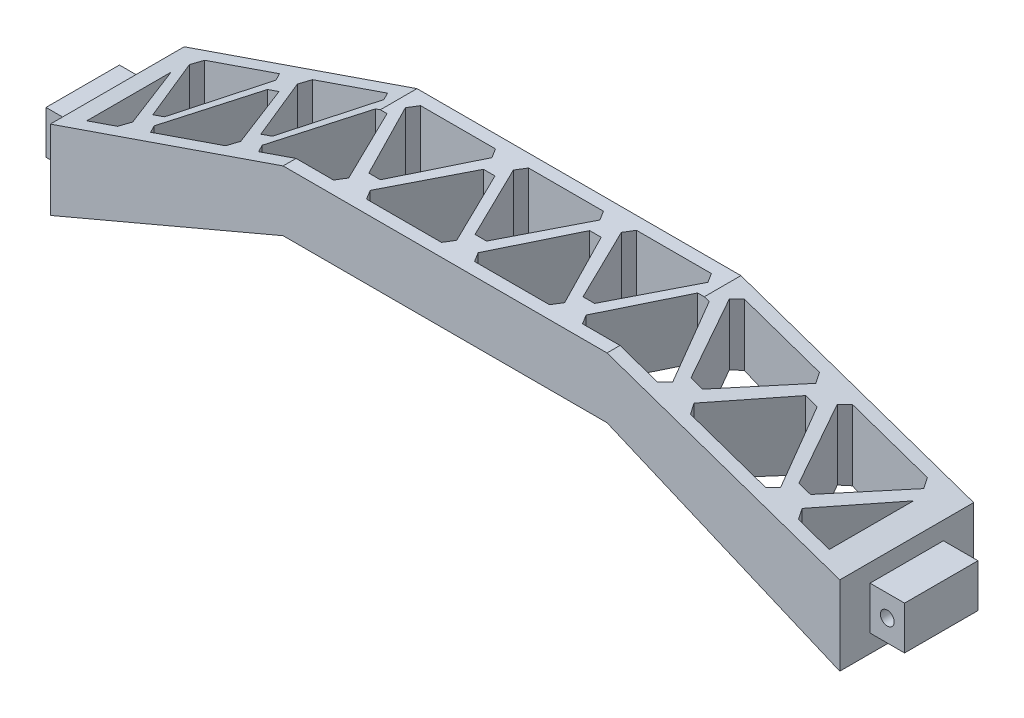
from build123d import *

# Parameters (mm, degrees)
CROQUIS1_W              = 37.5
CROQUIS1_H              = 14
SALIENTE_EXTRUIR1_DEPTH = 15.5
CROQUIS2_W              = 17
CROQUIS2_H              = 10
SALIENTE_EXTRUIR2_DEPTH = 8
CROQUIS3_R              = 1.6
CORTAR_EXTRUIR1_DEPTH   = 107.526693573
CORTAR_EXTRUIR2_DEPTH   = 108.142287781


with BuildPart() as part:
    # Croquis1 → Saliente-Extruir1 (new, symmetric)
    with BuildSketch(Plane.XY):
        Polygon((-91.394558809, -11.557384804), (-91.394558809, -29.877384804), (-37.5, -7), (-37.5, 7), align=None)
        Polygon((37.5, 7), (91.394558809, -11.557384804), (91.394558809, -29.877384804), (37.5, -7), align=None)
        with Locations((18.75, 0)):
            Rectangle(CROQUIS1_W, CROQUIS1_H)
        with Locations((-18.75, 0)):
            Rectangle(CROQUIS1_W, CROQUIS1_H)
    extrude(amount=SALIENTE_EXTRUIR1_DEPTH, both=True)

    # Croquis2 → Saliente-Extruir2 (add)
    with BuildSketch(Plane.ZY.offset(91.394558809)):
        with Locations((0, -20.717384804)):
            Rectangle(CROQUIS2_W, CROQUIS2_H)
    saliente_extruir2 = extrude(amount=SALIENTE_EXTRUIR2_DEPTH)

    # Croquis3 → Cortar-Extruir1 (cut, through all)
    with BuildSketch(Plane.XY.offset(8.5)):
        with Locations((-95.394558809, -20.717384804)):
            Circle(CROQUIS3_R)
    cortar_extruir1 = extrude(amount=-CORTAR_EXTRUIR1_DEPTH, mode=Mode.SUBTRACT)

    # Simetría1: Saliente-Extruir2, Cortar-Extruir1 across plane
    add(saliente_extruir2.mirror(Plane(origin=(0, 0, 0), x_dir=(0, 0, 1), z_dir=(1, 0, 0))))
    add(cortar_extruir1.mirror(Plane(origin=(0, 0, 0), x_dir=(0, 0, 1), z_dir=(1, 0, 0))), mode=Mode.SUBTRACT)

    # Croquis4 → Cortar-Extruir2 (cut, through all)
    with BuildSketch(Plane(origin=(0, 7, 0), x_dir=(1, 0, 0), z_dir=(0, 1, 0))):
        Polygon((-8.675, 12.5), (8.675, 12.5), (10.015331351, 10.33066557), (1.135565493, -7.02), (-1.544434507, -7.02), (-10.015331351, 10.33066557), align=None)
        Polygon((3.8246, -12.5), (2.484268649, -10.33066557), (10.955165493, 7.02), (13.635165493, 7.02), (22.514931351, -10.33066557), (21.1746, -12.5), align=None)
        Polygon((35.015331351, 10.33066557), (26.135565493, -7.02), (23.455565493, -7.02), (14.984668649, 10.33066557), (16.325, 12.5), (33.675, 12.5), align=None)
        Polygon((28.8246, -12.5), (27.484268649, -10.33066557), (35.955165493, 7.02), (38.635165493, 7.02), (47.514931351, -10.33066557), (46.1746, -12.5), align=None)
        Polygon((60.015331351, 10.33066557), (51.135565493, -7.02), (48.455565493, -7.02), (39.984668649, 10.33066557), (41.325, 12.5), (58.675, 12.5), align=None)
        Polygon((53.8246, -12.5), (52.484268649, -10.33066557), (60.955165493, 7.02), (63.635165493, 7.02), (72.514931351, -10.33066557), (71.1746, -12.5), align=None)
        Polygon((85.015331351, 10.33066557), (76.135565493, -7.02), (73.455565493, -7.02), (64.984668649, 10.33066557), (66.325, 12.5), (83.675, 12.5), align=None)
        Polygon((78.8246, -12.5), (77.484268649, -10.33066557), (85.955165493, 7.02), (85.955165493, -12.5), align=None)
        Polygon((-3.8246, -12.5), (-2.484268649, -10.33066557), (-10.955165493, 7.02), (-13.635165493, 7.02), (-22.514931351, -10.33066557), (-21.1746, -12.5), align=None)
        Polygon((-83.675, 12.5), (-85.015331351, 10.33066557), (-76.135565493, -7.02), (-73.455565493, -7.02), (-64.984668649, 10.33066557), (-66.325, 12.5), align=None)
        Polygon((-60.955165493, 7.02), (-63.635165493, 7.02), (-72.514931351, -10.33066557), (-71.1746, -12.5), (-53.8246, -12.5), (-52.484268649, -10.33066557), align=None)
        Polygon((-58.675, 12.5), (-60.015331351, 10.33066557), (-51.135565493, -7.02), (-48.455565493, -7.02), (-39.984668649, 10.33066557), (-41.325, 12.5), align=None)
        Polygon((-35.955165493, 7.02), (-38.635165493, 7.02), (-47.514931351, -10.33066557), (-46.1746, -12.5), (-28.8246, -12.5), (-27.484268649, -10.33066557), align=None)
        Polygon((-33.675, 12.5), (-35.015331351, 10.33066557), (-26.135565493, -7.02), (-23.455565493, -7.02), (-14.984668649, 10.33066557), (-16.325, 12.5), align=None)
        Polygon((-85.955165493, 7.02), (-85.955165493, -12.5), (-78.8246, -12.5), (-77.484268649, -10.33066557), align=None)
    extrude(amount=-CORTAR_EXTRUIR2_DEPTH, mode=Mode.SUBTRACT)


solid = part.part
